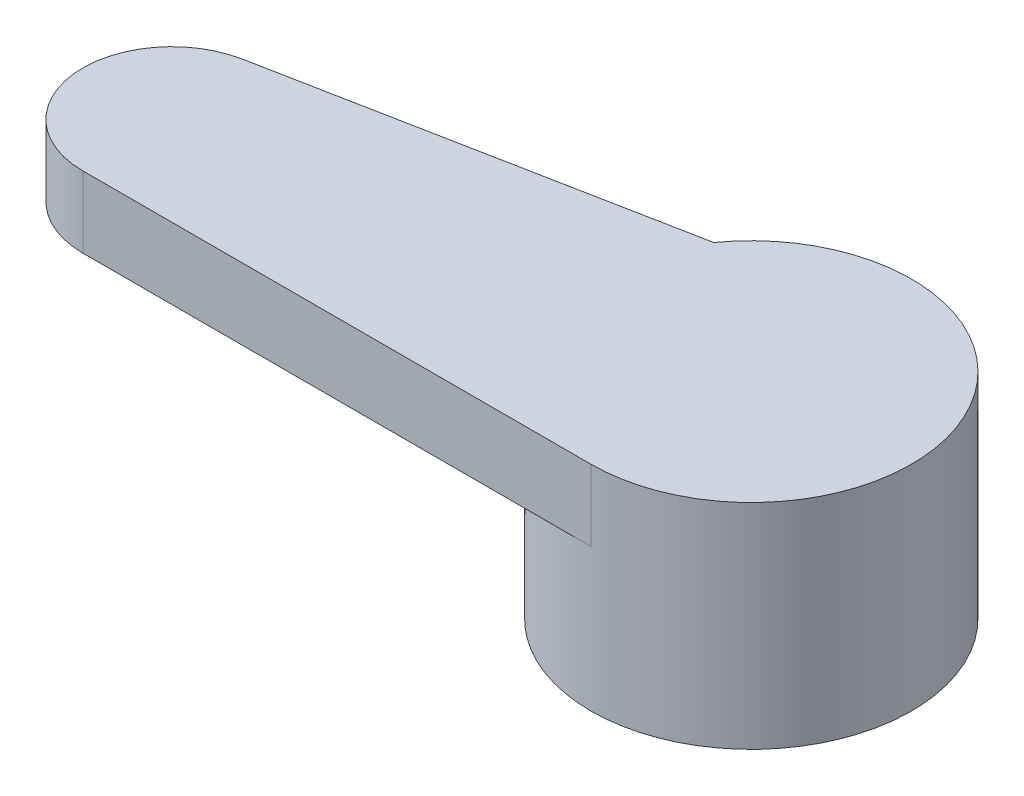
from build123d import *

# Parameters (mm, degrees)
SKETCH1_R           = 4.5
BOSS_EXTRUDE1_DEPTH = 6
BOSS_EXTRUDE2_START = -2
BOSS_EXTRUDE2_DEPTH = 2


with BuildPart() as part:
    # Sketch1 → Boss-Extrude1 (new body)
    with BuildSketch(Plane(origin=(0, 0, 0), x_dir=(1, 0, 0), z_dir=(0, 1, 0))):
        with Locations(Location((0, 0, 0), (0, 0, 270))):
            Circle(SKETCH1_R)
    extrude(amount=BOSS_EXTRUDE1_DEPTH)

    # Sketch2 → Boss-Extrude2 (add)
    with BuildSketch(Plane(origin=(0, 6, 0), x_dir=(1, 0, 0), z_dir=(0, 1, 0)).offset(BOSS_EXTRUDE2_START)):
        with BuildLine():
            Line((0, -4.5), (-14.260434776, -4.5))
            ThreePointArc((-14.260434776, -4.5), (-16.748875469, -2.240131045), (-14.738476268, 0.453869665))
            Line((-14.738476268, 0.453869665), (-3.664982778, 2.611111111))
            ThreePointArc((-3.664982778, 2.611111111), (-4, -2.061552813), (0, -4.5))
        make_face()
    extrude(amount=BOSS_EXTRUDE2_DEPTH)


solid = part.part
